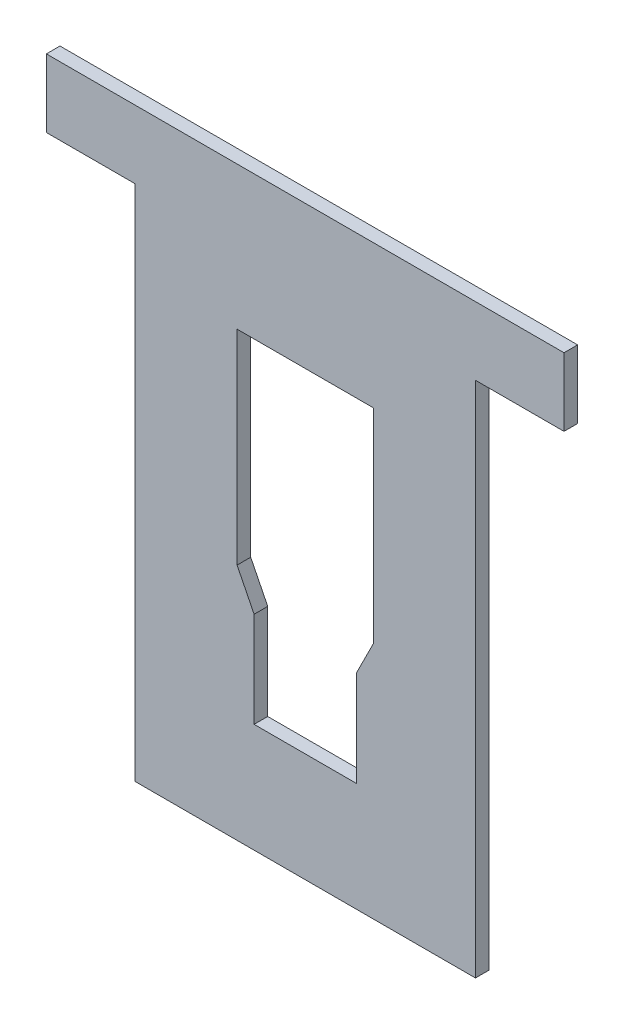
from build123d import *

# Parameters (mm, degrees)
BOSS_EXTRUDE1_DEPTH = 0.508


with BuildPart() as part:
    # Sketch1 → Boss-Extrude1 (new body)
    with BuildSketch(Plane.XY):
        Polygon((0, 0), (12.7, 0), (12.7, 19.304), (16.002, 19.304), (16.002, 21.844), (-3.302, 21.844), (-3.302, 19.304), (0, 19.304), align=None)
        Polygon((3.81, 16.51), (8.89, 16.51), (8.89, 8.89), (8.255, 7.62), (8.255, 4.064), (4.445, 4.064), (4.445, 7.62), (3.81, 8.89), align=None, mode=Mode.SUBTRACT)
    extrude(amount=BOSS_EXTRUDE1_DEPTH)


solid = part.part
